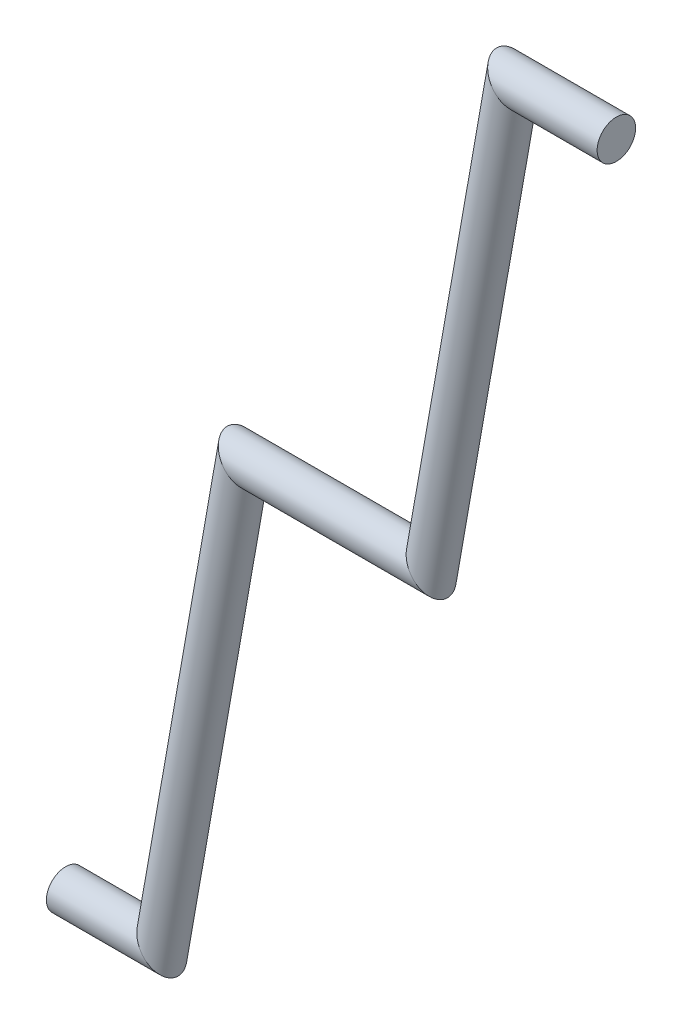
from build123d import *

# Parameters (mm, degrees)
SKETCH4_R = 6.35


with BuildPart() as part:
    # Sweep3: sweep along a path in Sketch5
    with BuildLine(Plane.XY) as sweep3_path:
        Line((0, 0), (31.75, 0))
        Line((31.75, 0), (58.62223186, 152.4))
        Line((58.62223186, 152.4), (90.37223186, 152.4))
        Line((90.37223186, 152.4), (120.549008468, 152.4))
        Line((120.549008468, 152.4), (147.421240328, 304.8))
        Line((147.421240328, 304.8), (181.551345013, 304.8))
    # Sketch4 → Sweep3 (sweep)
    with BuildSketch(Plane(origin=(0, 0, 0), x_dir=(0, 0, -1), z_dir=(1, 0, 0))):
        Circle(SKETCH4_R)
    sweep(path=sweep3_path.line, transition=Transition.RIGHT)


solid = part.part
